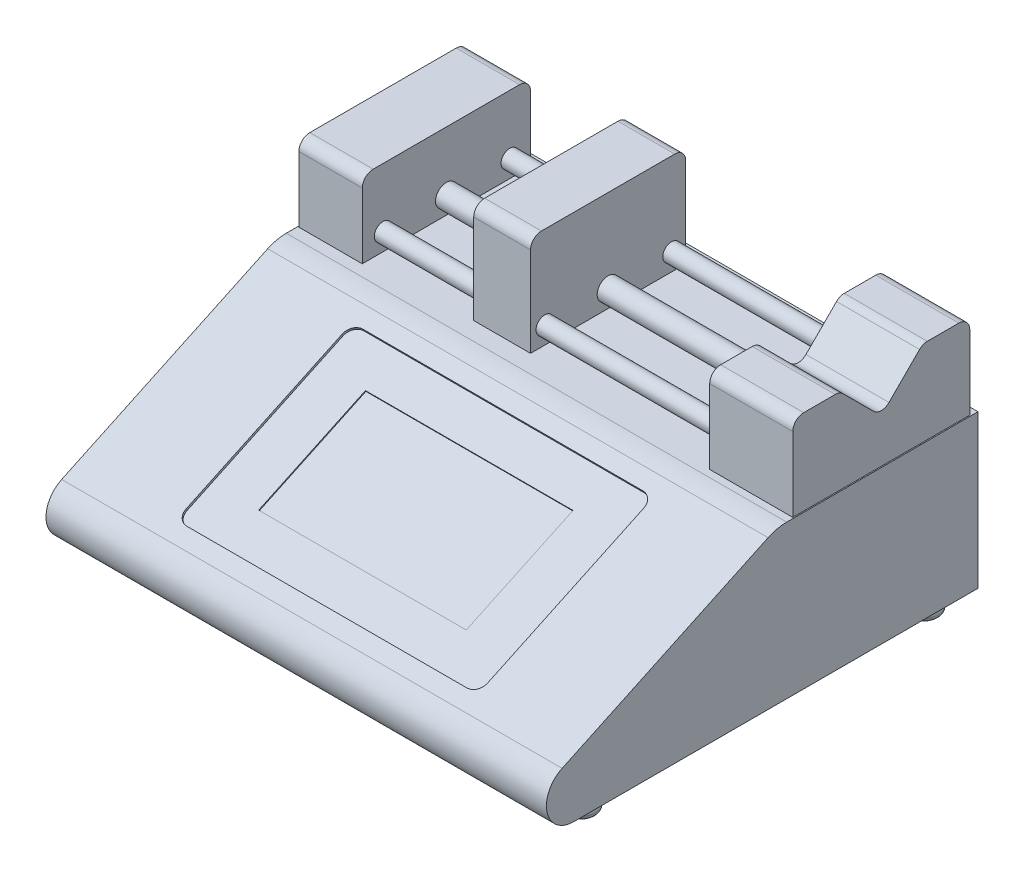
from build123d import *

# Parameters (mm, degrees)
BOSS_EXTRUDE1_DEPTH = 229
FILLET1_R           = 20
SKETCH2_W           = 138
SKETCH2_H           = 89
CUT_EXTRUDE1_DEPTH  = 1
FILLET2_R           = 5
SKETCH3_W           = 29
SKETCH3_H           = 77
BOSS_EXTRUDE2_DEPTH = 35
FILLET3_R           = 5
SKETCH4_W           = 38
SKETCH4_H           = 81
BOSS_EXTRUDE3_DEPTH = 39
CUT_EXTRUDE2_REACH  = 323.447
FILLET4_R           = 5
SKETCH6_W           = 26
SKETCH6_H           = 71
BOSS_EXTRUDE4_DEPTH = 46
FILLET5_R           = 5
BOSS_EXTRUDE5_REACH = 299.914
SKETCH7_R           = 4
SKETCH7_R_2         = 5
SKETCH8_W           = 95
SKETCH8_H           = 54
CUT_EXTRUDE3_DEPTH  = 0.5
SKETCH9_R           = 7
BOSS_EXTRUDE6_DEPTH = 7.5
FILLET6_R           = 2


with BuildPart() as part:
    # Sketch1 → Boss-Extrude1 (new body)
    with BuildSketch(Plane(origin=(0, 0, 0), x_dir=(0, 0, -1), z_dir=(1, 0, 0))):
        with BuildLine():
            Line((0, 0), (-185, 0))
            ThreePointArc((-185, 0), (-197.19983645, 9.777135593), (-190.314960072, 23.813761507))
            Line((-190.314960072, 23.813761507), (-92, 70))
            Line((-92, 70), (0, 70))
            Line((0, 70), (0, 0))
        make_face()
    extrude(amount=BOSS_EXTRUDE1_DEPTH)

    # Fillet1
    fillet1_edges = [part.edges().sort_by_distance(p)[0] for p in [
        (114.5, 70, 92),
    ]]
    fillet(fillet1_edges, radius=FILLET1_R)

    # Sketch2 → Cut-Extrude1 (cut)
    with BuildSketch(Plane(origin=(0, 92.750371214, 43.572115191), x_dir=(1, 0, 0), z_dir=(0, 0.9051009205620354, 0.42519680572383906))):
        with Locations((114.5, -110.048995253)):
            Rectangle(SKETCH2_W, SKETCH2_H)
    extrude(amount=-CUT_EXTRUDE1_DEPTH, mode=Mode.SUBTRACT)

    # Fillet2
    fillet2_edges = [part.edges().sort_by_distance(p)[0] for p in [
        (45.5, 26.584081644, 183.241954664),
        (45.5, 64.426597354, 102.687972734),
        (183.5, 64.426597354, 102.687972734),
        (183.5, 26.584081644, 183.241954664),
    ]]
    fillet(fillet2_edges, radius=FILLET2_R)

    # Sketch3 → Boss-Extrude2 (add)
    with BuildSketch(Plane(origin=(0, 70, 0), x_dir=(1, 0, 0), z_dir=(0, 1, 0))):
        with Locations((15, -43.768114008)):
            Rectangle(SKETCH3_W, SKETCH3_H)
    extrude(amount=BOSS_EXTRUDE2_DEPTH)

    # Fillet3
    fillet3_edges = [part.edges().sort_by_distance(p)[0] for p in [
        (15, 105, 5.268114008),
        (15, 105, 82.268114008),
    ]]
    fillet(fillet3_edges, radius=FILLET3_R)

    # Sketch4 → Boss-Extrude3 (add)
    with BuildSketch(Plane(origin=(0, 70, 0), x_dir=(1, 0, 0), z_dir=(0, 1, 0))):
        with Locations((209.5, -43.768114008)):
            Rectangle(SKETCH4_W, SKETCH4_H)
    extrude(amount=BOSS_EXTRUDE3_DEPTH)

    # Sketch5 → Cut-Extrude2 (cut, up to next)
    with BuildSketch(Plane(origin=(229, 0, 0), x_dir=(0, 0, -1), z_dir=(1, 0, 0)), mode=Mode.PRIVATE) as cut_extrude2_sk1:
        Polygon((-62.768114008, 109), (-43.768114008, 90), (-24.768114008, 109), align=None)
    cut_extrude2_tool1 = extrude(cut_extrude2_sk1.sketch, amount=-CUT_EXTRUDE2_REACH, mode=Mode.PRIVATE) & part.part
    add(cut_extrude2_tool1.solids().sort_by_distance((229, 102.666667, 43.768114))[0], mode=Mode.SUBTRACT)

    # Fillet4
    fillet4_edges = [part.edges().sort_by_distance(p)[0] for p in [
        (209.5, 90, 43.768114008),
        (209.5, 109, 24.768114008),
        (209.5, 109, 62.768114008),
        (209.5, 109, 3.268114008),
        (209.5, 109, 84.268114008),
    ]]
    fillet(fillet4_edges, radius=FILLET4_R)

    # Sketch6 → Boss-Extrude4 (add)
    with BuildSketch(Plane(origin=(0, 70, 0), x_dir=(1, 0, 0), z_dir=(0, 1, 0))):
        with Locations((90.5, -43.768114008)):
            Rectangle(SKETCH6_W, SKETCH6_H)
    extrude(amount=BOSS_EXTRUDE4_DEPTH)

    # Fillet5
    fillet5_edges = [part.edges().sort_by_distance(p)[0] for p in [
        (90.5, 116, 8.268114008),
        (90.5, 116, 79.268114008),
    ]]
    fillet(fillet5_edges, radius=FILLET5_R)

    # Boss-Extrude5: up to this face of the body (flat: up to its plane)
    boss_extrude5_end = Plane(part.part.faces().sort_by_distance((29.5, 87.434510008, 43.768114008))[0])
    # Sketch7 → Boss-Extrude5 (add, up to the picked face)
    with BuildSketch(Plane.ZY.offset(-190.5), mode=Mode.PRIVATE) as boss_extrude5_sk1:
        with Locations(Location((14.768114008, 78, 0), (0, 0, 180))):
            Circle(SKETCH7_R)
    boss_extrude5_tool1 = split(extrude(boss_extrude5_sk1.sketch, amount=BOSS_EXTRUDE5_REACH, mode=Mode.PRIVATE), bisect_by=boss_extrude5_end, keep=Keep.BOTH, mode=Mode.PRIVATE)
    # Sketch7 → Boss-Extrude5 (add, up to the picked face)
    with BuildSketch(Plane.ZY.offset(-190.5), mode=Mode.PRIVATE) as boss_extrude5_sk2:
        with Locations(Location((43.768114008, 78, 0), (0, 0, 180))):
            Circle(SKETCH7_R_2)
    boss_extrude5_tool2 = split(extrude(boss_extrude5_sk2.sketch, amount=BOSS_EXTRUDE5_REACH, mode=Mode.PRIVATE), bisect_by=boss_extrude5_end, keep=Keep.BOTH, mode=Mode.PRIVATE)
    # Sketch7 → Boss-Extrude5 (add, up to the picked face)
    with BuildSketch(Plane.ZY.offset(-190.5), mode=Mode.PRIVATE) as boss_extrude5_sk3:
        with Locations(Location((72.768114008, 78, 0), (0, 0, 180))):
            Circle(SKETCH7_R)
    boss_extrude5_tool3 = split(extrude(boss_extrude5_sk3.sketch, amount=BOSS_EXTRUDE5_REACH, mode=Mode.PRIVATE), bisect_by=boss_extrude5_end, keep=Keep.BOTH, mode=Mode.PRIVATE)
    add(boss_extrude5_tool1.solids().sort_by(Axis((190.5, 78, 14.768114), (-1, 0, 0)))[0])
    add(boss_extrude5_tool2.solids().sort_by(Axis((190.5, 78, 43.768114), (-1, 0, 0)))[0])
    add(boss_extrude5_tool3.solids().sort_by(Axis((190.5, 78, 72.768114), (-1, 0, 0)))[0])

    # Sketch8 → Cut-Extrude3 (cut)
    with BuildSketch(Plane(origin=(0, 91.845270293, 43.146918385), x_dir=(1, 0, 0), z_dir=(0, 0.9051009205620354, 0.425196805723839))):
        with Locations((114.5, -110.048995253)):
            Rectangle(SKETCH8_W, SKETCH8_H)
    extrude(amount=-CUT_EXTRUDE3_DEPTH, mode=Mode.SUBTRACT)

    # Sketch9 → Boss-Extrude6 (add)
    with BuildSketch(Plane(origin=(0, 0, 0), x_dir=(-1, 0, 0), z_dir=(0, -1, 0))):
        with Locations(Location((-11, -171, 0), (0, 0, 270))):
            Circle(SKETCH9_R)
        with Locations(Location((-11, -14, 0), (0, 0, 270))):
            Circle(SKETCH9_R)
        with Locations(Location((-218, -171, 0), (0, 0, 270))):
            Circle(SKETCH9_R)
        with Locations(Location((-218, -14, 0), (0, 0, 270))):
            Circle(SKETCH9_R)
    extrude(amount=BOSS_EXTRUDE6_DEPTH)

    # Fillet6
    fillet6_edges = [part.edges().sort_by_distance(p)[0] for p in [
        (218, -7.5, 7),
        (218, -7.5, 164),
        (11, -7.5, 164),
        (11, -7.5, 7),
    ]]
    fillet(fillet6_edges, radius=FILLET6_R)


solid = part.part
